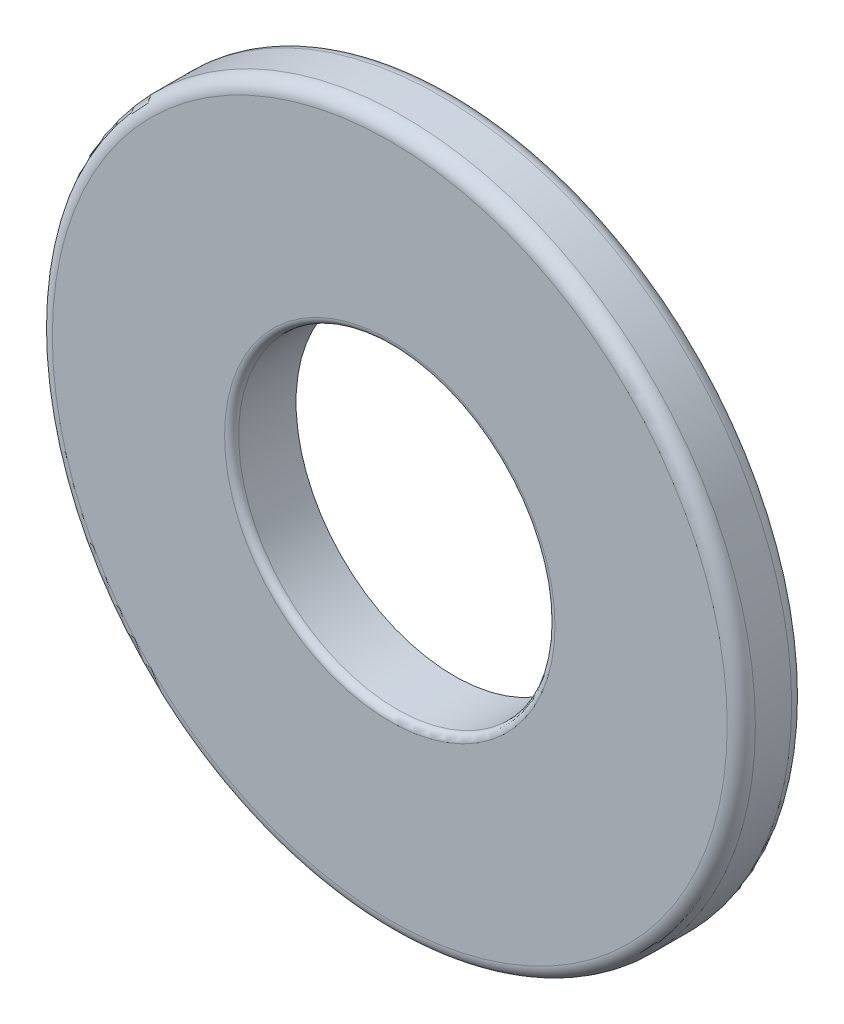
from build123d import *

# Parameters (mm, degrees)
BOSS_EXTRUDE1_DEPTH      = 0.275
BOSS_EXTRUDE1_DEPTH_BACK = 0.275
SKETCH3_R                = 3
SKETCH3_R_2              = 1.35
FILLET1_R                = 0.12
FILLET2_R                = 0.06


with BuildPart() as part:
    # Sketch3 → Boss-Extrude1 (new, two sides: drawn at the far end of the back side and taken through both)
    with BuildSketch(Plane.XY.offset(-BOSS_EXTRUDE1_DEPTH_BACK)):
        Circle(SKETCH3_R)
        Circle(SKETCH3_R_2, mode=Mode.SUBTRACT)
    extrude(amount=BOSS_EXTRUDE1_DEPTH + BOSS_EXTRUDE1_DEPTH_BACK)

    # Fillet1
    fillet1_edges = [part.edges().sort_by_distance(p)[0] for p in [
        (-3, 0, -0.275),
        (-3, 0, 0.275),
    ]]
    fillet(fillet1_edges, radius=FILLET1_R)

    # Fillet2
    fillet2_edges = [part.edges().sort_by_distance(p)[0] for p in [
        (-1.35, 0, 0.275),
    ]]
    fillet(fillet2_edges, radius=FILLET2_R)


solid = part.part
